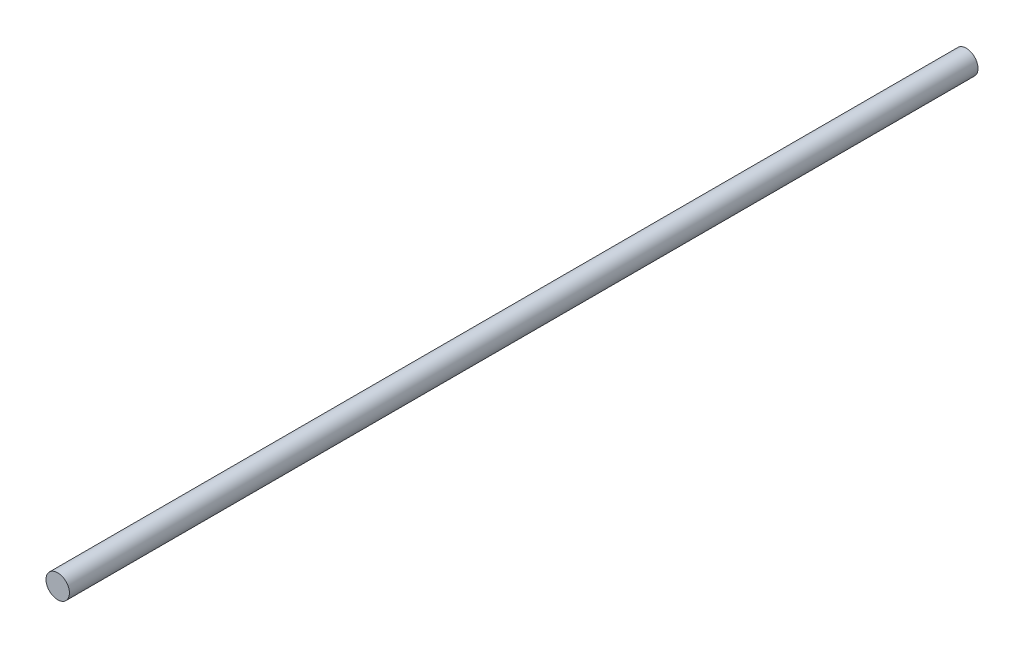
from build123d import *

# Parameters (mm, degrees)
ESQUISSE1_R        = 4
BOSS_EXTRU_1_DEPTH = 310


with BuildPart() as part:
    # Esquisse1 → Boss.-Extru.1 (new body)
    with BuildSketch(Plane.XY):
        Circle(ESQUISSE1_R)
    extrude(amount=BOSS_EXTRU_1_DEPTH)


solid = part.part
